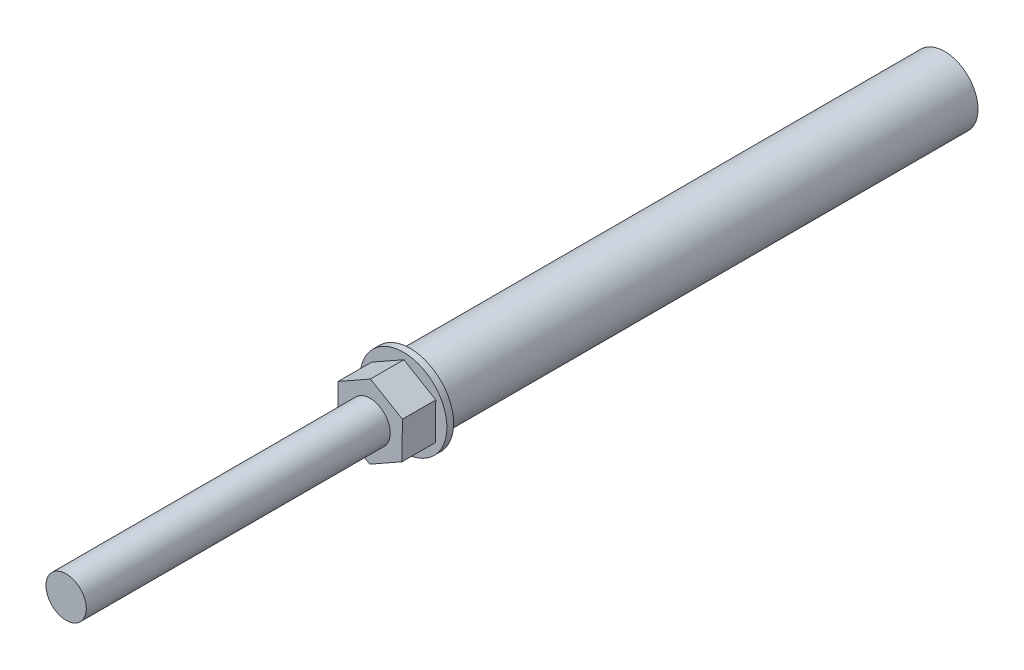
from build123d import *

# Parameters (mm, degrees)
SKETCH1_R           = 5
BOSS_EXTRUDE1_DEPTH = 80
SKETCH2_R           = 6.5
BOSS_EXTRUDE2_DEPTH = 1
BOSS_EXTRUDE5_DEPTH = 5
SKETCH6_R           = 3.019653564
BOSS_EXTRUDE6_DEPTH = 45.5


with BuildPart() as part:
    # Sketch1 → Boss-Extrude1 (new body)
    with BuildSketch(Plane.XY):
        Circle(SKETCH1_R)
    extrude(amount=BOSS_EXTRUDE1_DEPTH)

    # Sketch2 → Boss-Extrude2 (add)
    with BuildSketch(Plane.XY.offset(80)):
        Circle(SKETCH2_R)
    extrude(amount=BOSS_EXTRUDE2_DEPTH)

    # Sketch5 → Boss-Extrude5 (add)
    with BuildSketch(Plane.XY.offset(81)):
        Polygon((4.778851136, -2.820156932), (4.831753114, 2.728528019), (0.052901978, 5.548684951), (-4.778851136, 2.820156932), (-4.831753114, -2.728528019), (-0.052901978, -5.548684951), align=None)
    extrude(amount=BOSS_EXTRUDE5_DEPTH)

    # Sketch6 → Boss-Extrude6 (add)
    with BuildSketch(Plane.XY.offset(86)):
        Circle(SKETCH6_R)
    extrude(amount=BOSS_EXTRUDE6_DEPTH)


solid = part.part
